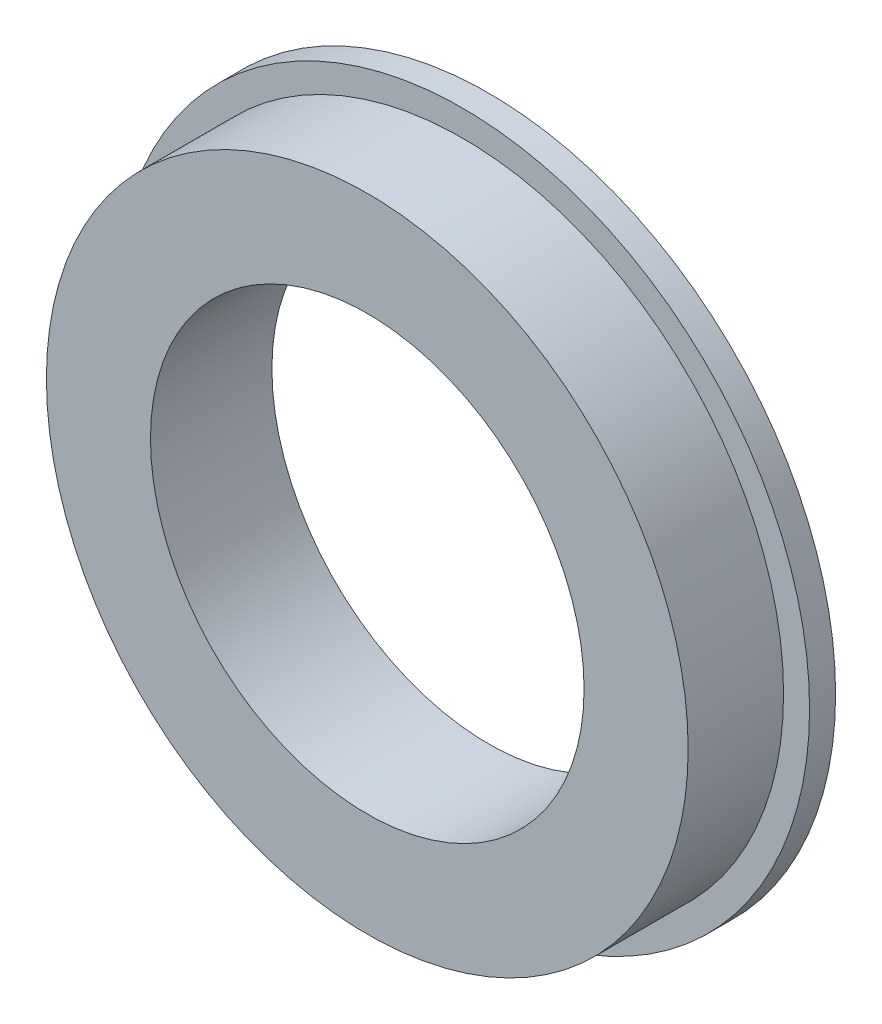
from build123d import *
from build123d.topology import SkipClean

# Parameters (mm, degrees)
SKETCH_1_R      = 18.5
SKETCH_1_R_2    = 12.5
EXTRUDE_1_DEPTH = 5.5
EXTRUDE_START   = 1.5
SKETCH_2_R      = 20
SKETCH_2_R_2    = 12.5
EXTRUDE_2_DEPTH = 1.5


with BuildPart() as part:
    # 草图1 → 凸台-拉伸1 (new body)
    with BuildSketch(Plane.XY):
        Circle(SKETCH_1_R)
        Circle(SKETCH_1_R_2, mode=Mode.SUBTRACT)
    extrude(amount=EXTRUDE_1_DEPTH)

    # 草图2 → 凸台-拉伸2 (add)
    with SkipClean():  # the faces are left unmerged after this step: merging them gives an invalid solid
        with BuildSketch(Plane(origin=(0, 0, 0), x_dir=(-1, 0, 0), z_dir=(0, 0, -1)).offset(EXTRUDE_START)):
            Circle(SKETCH_2_R)
            Circle(SKETCH_2_R_2, mode=Mode.SUBTRACT)
        extrude(amount=-EXTRUDE_2_DEPTH)


solid = part.part
